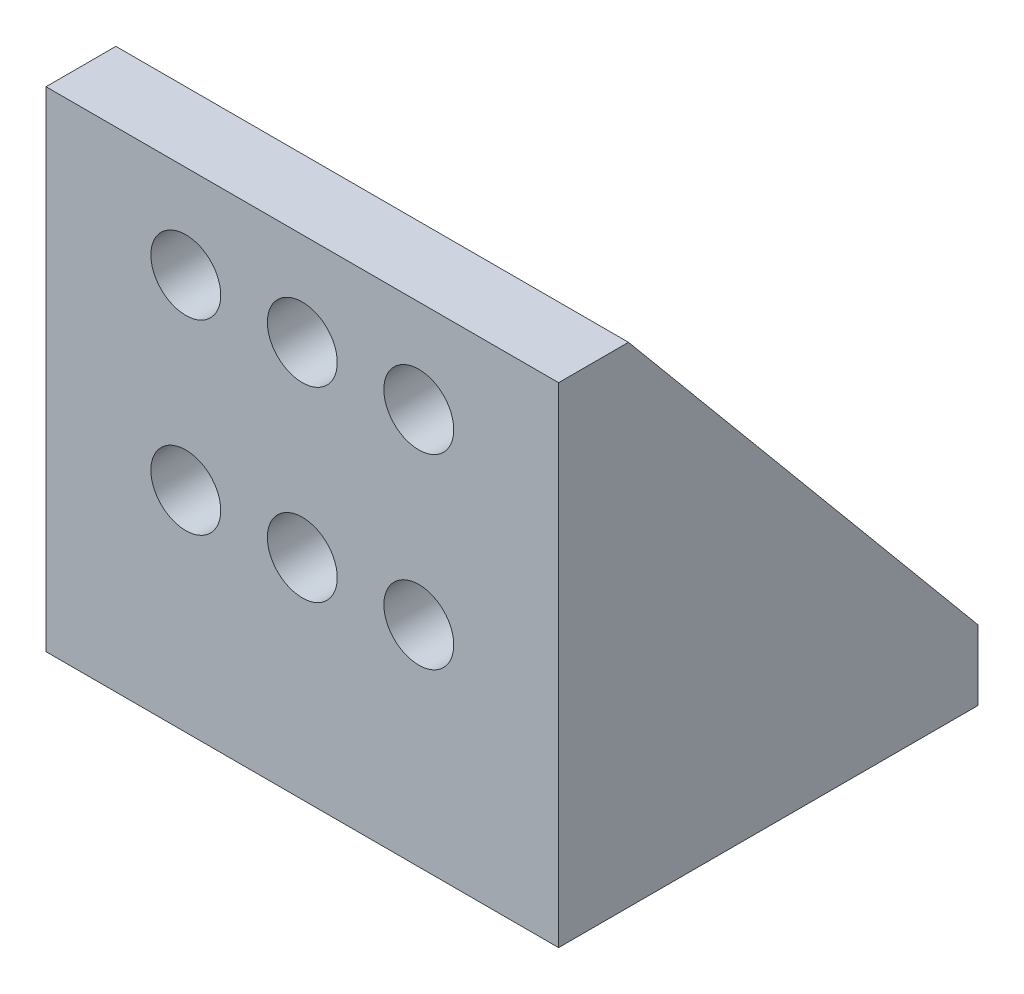
from build123d import *

# Parameters (mm, degrees)
EXTRUDE_1_DEPTH     = 22
SKETCH_2_R          = 1.5
CUT_EXTRUDE_1_DEPTH = 13
EXTRUDE_2_DEPTH     = 3
EXTRUDE_3_DEPTH     = 3
SKETCH_5_R          = 1.5
CUT_EXTRUDE_2_DEPTH = 3


with BuildPart() as part:
    # 草图1 → 凸台-拉伸1 (new body)
    with BuildSketch(Plane(origin=(0, 0, 0), x_dir=(0, 0, -1), z_dir=(1, 0, 0))):
        Polygon((0, 0), (0, 21), (3, 21), (3, 3), (18, 3), (18, 0), align=None)
    extrude(amount=EXTRUDE_1_DEPTH)

    # 草图2 → 切除-拉伸1 (cut)
    with BuildSketch(Plane(origin=(0, 3, 0), x_dir=(1, 0, 0), z_dir=(0, 1, 0))):
        with Locations(Location((11, 5.8, 0), (0, 0, 270))):
            Circle(SKETCH_2_R)
        with Locations(Location((11, 13.8, 0), (0, 0, 270))):
            Circle(SKETCH_2_R)
        with Locations(Location((16, 5.8, 0), (0, 0, 270))):
            Circle(SKETCH_2_R)
        with Locations(Location((16, 13.8, 0), (0, 0, 270))):
            Circle(SKETCH_2_R)
        with Locations(Location((6, 13.8, 0), (0, 0, 270))):
            Circle(SKETCH_2_R)
        with Locations(Location((6, 5.8, 0), (0, 0, 270))):
            Circle(SKETCH_2_R)
    extrude(amount=-CUT_EXTRUDE_1_DEPTH, mode=Mode.SUBTRACT)

    # 草图3 → 凸台-拉伸2 (add)
    with BuildSketch(Plane(origin=(22, 0, 0), x_dir=(0, 0, -1), z_dir=(1, 0, 0))):
        Polygon((3, 21), (18, 3), (3, 3), align=None)
    extrude(amount=-EXTRUDE_2_DEPTH)

    # 草图4 → 凸台-拉伸3 (add)
    with BuildSketch(Plane.ZY):
        Polygon((-18, 3), (-3, 3), (-3, 21), align=None)
    extrude(amount=-EXTRUDE_3_DEPTH)

    # 草图5 → 切除-拉伸2 (cut)
    with BuildSketch(Plane.XY):
        with Locations((11, 17)):
            Circle(SKETCH_5_R)
        with Locations((11, 9)):
            Circle(SKETCH_5_R)
        with Locations((6, 17)):
            Circle(SKETCH_5_R)
        with Locations((6, 9)):
            Circle(SKETCH_5_R)
        with Locations(Location((16, 9, 0), (0, 0, 180))):
            Circle(SKETCH_5_R)
        with Locations(Location((16, 17, 0), (0, 0, 180))):
            Circle(SKETCH_5_R)
    extrude(amount=-CUT_EXTRUDE_2_DEPTH, mode=Mode.SUBTRACT)


solid = part.part
